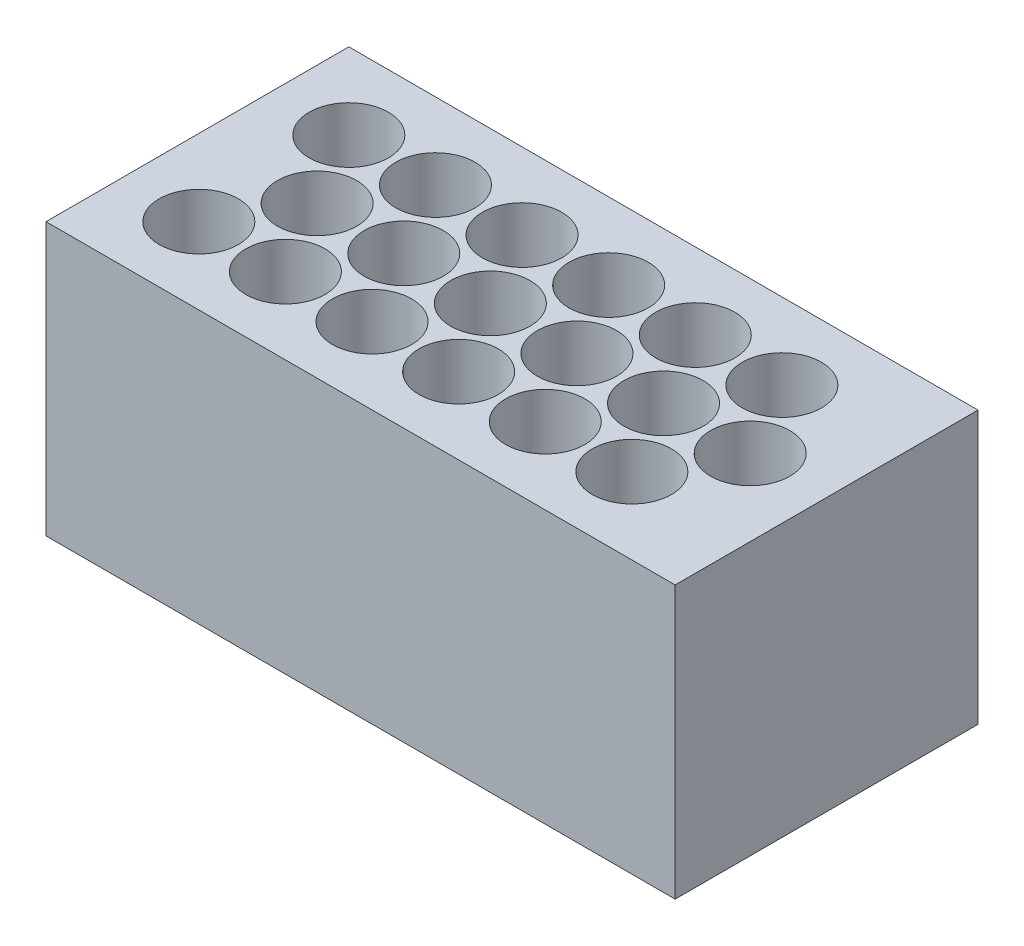
from build123d import *

# Parameters (mm, degrees)
SKETCH1_W           = 171.075
SKETCH1_H           = 82.339796518
SKETCH1_R           = 10.775
BOSS_EXTRUDE1_DEPTH = 74
SKETCH2_R           = 2.5
CUT_EXTRUDE1_DEPTH  = 12.5


with BuildPart() as part:
    # Sketch1 → Boss-Extrude1 (new body)
    with BuildSketch(Plane(origin=(0, 0, 0), x_dir=(1, 0, 0), z_dir=(0, 1, 0))):
        with Locations((52.9875, 0)):
            Rectangle(SKETCH1_W, SKETCH1_H)
        Circle(SKETCH1_R, mode=Mode.SUBTRACT)
        with Locations((-11.775, 20.394898259)):
            Circle(SKETCH1_R, mode=Mode.SUBTRACT)
        with Locations((-11.775, -20.394898259)):
            Circle(SKETCH1_R, mode=Mode.SUBTRACT)
        with Locations((11.775, 20.394898259)):
            Circle(SKETCH1_R, mode=Mode.SUBTRACT)
        with Locations((23.55, 0)):
            Circle(SKETCH1_R, mode=Mode.SUBTRACT)
        with Locations((11.775, -20.394898259)):
            Circle(SKETCH1_R, mode=Mode.SUBTRACT)
        with Locations((35.325, 20.394898259)):
            Circle(SKETCH1_R, mode=Mode.SUBTRACT)
        with Locations((47.1, 0)):
            Circle(SKETCH1_R, mode=Mode.SUBTRACT)
        with Locations((35.325, -20.394898259)):
            Circle(SKETCH1_R, mode=Mode.SUBTRACT)
        with Locations((58.875, 20.394898259)):
            Circle(SKETCH1_R, mode=Mode.SUBTRACT)
        with Locations((70.65, 0)):
            Circle(SKETCH1_R, mode=Mode.SUBTRACT)
        with Locations((58.875, -20.394898259)):
            Circle(SKETCH1_R, mode=Mode.SUBTRACT)
        with Locations((82.425, 20.394898259)):
            Circle(SKETCH1_R, mode=Mode.SUBTRACT)
        with Locations((94.2, 0)):
            Circle(SKETCH1_R, mode=Mode.SUBTRACT)
        with Locations((82.425, -20.394898259)):
            Circle(SKETCH1_R, mode=Mode.SUBTRACT)
        with Locations((105.975, 20.394898259)):
            Circle(SKETCH1_R, mode=Mode.SUBTRACT)
        with Locations((117.75, 0)):
            Circle(SKETCH1_R, mode=Mode.SUBTRACT)
        with Locations((105.975, -20.394898259)):
            Circle(SKETCH1_R, mode=Mode.SUBTRACT)
    extrude(amount=BOSS_EXTRUDE1_DEPTH)

    # Sketch2 → Cut-Extrude1 (cut)
    with BuildSketch(Plane.ZY.offset(32.55)):
        with Locations((-37.329831377, 70.010492375)):
            Circle(SKETCH2_R)
        with Locations((36.747951512, 70.905692168)):
            Circle(SKETCH2_R)
        with Locations((34.733751977, 6.451307056)):
            Circle(SKETCH2_R)
        with Locations((-37.777431274, 5.645627242)):
            Circle(SKETCH2_R)
    extrude(amount=-CUT_EXTRUDE1_DEPTH, mode=Mode.SUBTRACT)


solid = part.part
